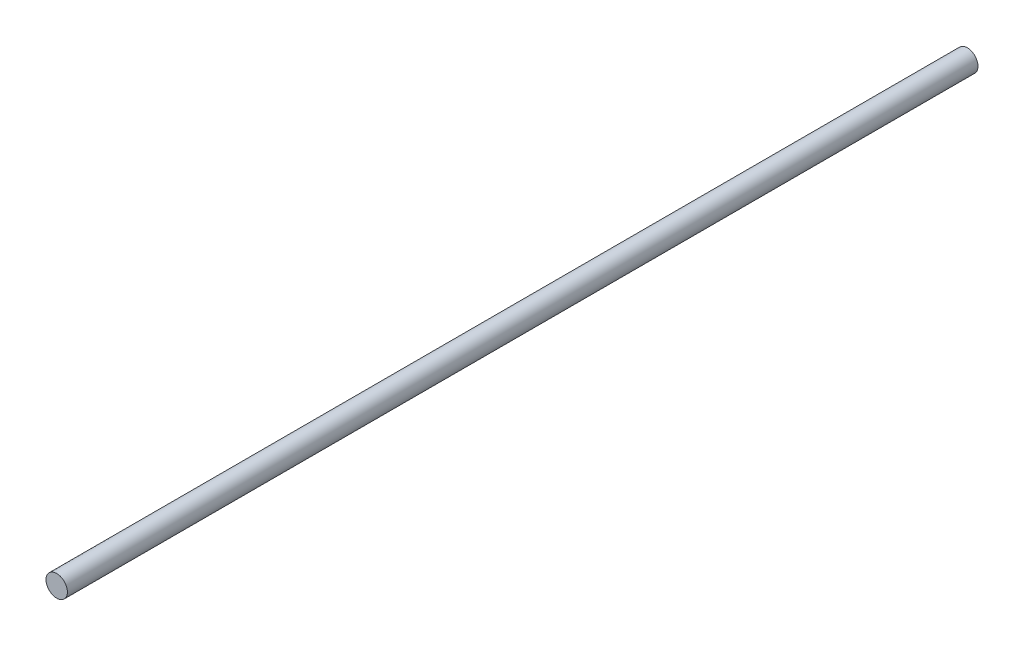
from build123d import *

# Parameters (mm, degrees)
SKETCH1_R           = 2
BOSS_EXTRUDE1_DEPTH = 85


with BuildPart() as part:
    # Sketch1 → Boss-Extrude1 (new, symmetric)
    with BuildSketch(Plane.XY):
        Circle(SKETCH1_R)
    extrude(amount=BOSS_EXTRUDE1_DEPTH, both=True)


solid = part.part
